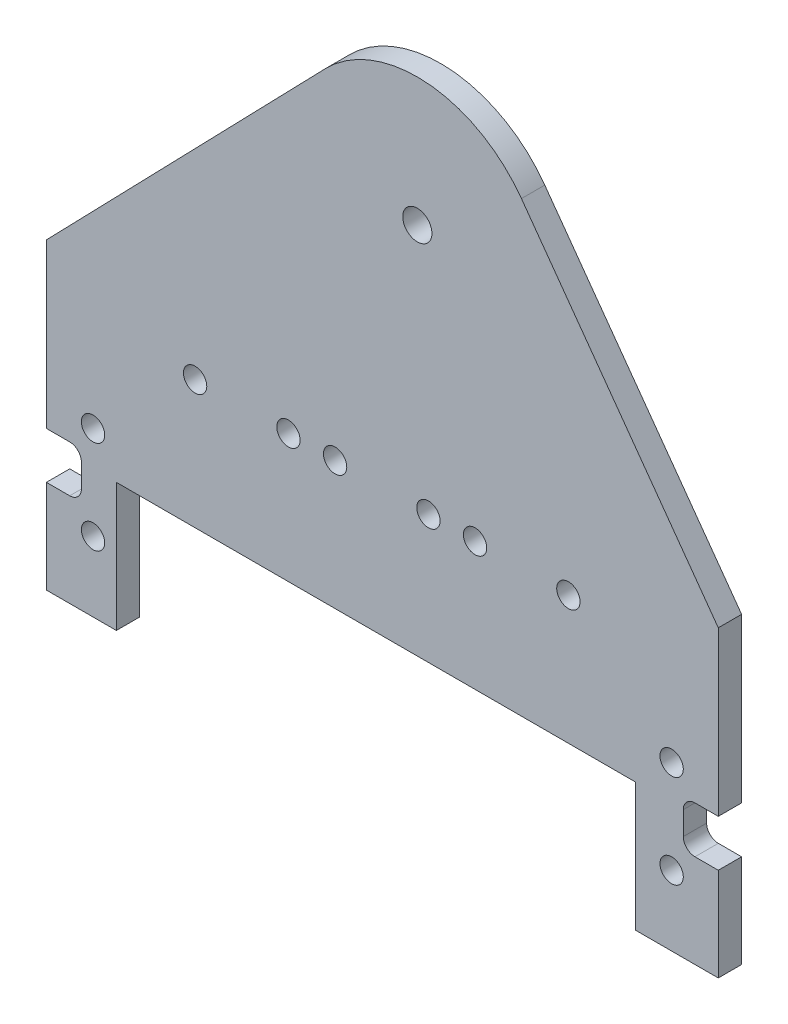
from build123d import *

# Parameters (mm, degrees)
SKETCH_1_R      = 1.25
SKETCH_1_R_2    = 1
EXTRUDE_1_DEPTH = 2


with BuildPart() as part:
    # 草圖1 → 填料-伸長1 (new body)
    with BuildSketch(Plane.XY):
        with BuildLine():
            Line((-28.8, -32), (-28.8, -34))
            ThreePointArc((-28.8, -34), (-29.092893219, -34.707106781), (-29.8, -35))
            Line((-29.8, -35), (-31.8, -35))
            Line((-31.8, -35), (-31.8, -36))
            Line((-31.8, -36), (-31.8, -42))
            Line((-31.8, -42), (-31.8, -43))
            Line((-31.8, -43), (-30.8, -43))
            Line((-30.8, -43), (-26.8, -43))
            Line((-26.8, -43), (-25.8, -43))
            Line((-25.8, -43), (-25.8, -32))
            Line((-25.8, -32), (18.7, -32))
            Line((18.7, -32), (18.7, -43))
            Line((18.7, -43), (24.8, -43))
            Line((24.8, -43), (25.8, -43))
            Line((25.8, -43), (25.8, -42))
            Line((25.8, -42), (25.8, -36))
            Line((25.8, -36), (25.8, -35))
            Line((25.8, -35), (23.8, -35))
            ThreePointArc((23.8, -35), (23.092893219, -34.707106781), (22.8, -34))
            Line((22.8, -34), (22.8, -32))
            ThreePointArc((22.8, -32), (23.092893219, -31.292893219), (23.8, -31))
            Line((23.8, -31), (25.8, -31))
            Line((25.8, -31), (25.8, -18))
            Line((25.8, -18), (25.8, -17))
            Line((25.8, -17), (8.925896882, 6.428714091))
            ThreePointArc((8.925896882, 6.428714091), (0.800566406, 10.970829204), (-7.898074186, 7.656397596))
            Line((-7.898074186, 7.656397596), (-31.8, -17))
            Line((-31.8, -17), (-31.8, -18))
            Line((-31.8, -18), (-31.8, -31))
            Line((-31.8, -31), (-29.8, -31))
            ThreePointArc((-29.8, -31), (-29.092893219, -31.292893219), (-28.8, -32))
        make_face()
        Circle(SKETCH_1_R, mode=Mode.SUBTRACT)
        with Locations((-19.05, -21)):
            Circle(SKETCH_1_R_2, mode=Mode.SUBTRACT)
        with Locations((-11.05, -21)):
            Circle(SKETCH_1_R_2, mode=Mode.SUBTRACT)
        with Locations((4.95, -21)):
            Circle(SKETCH_1_R_2, mode=Mode.SUBTRACT)
        with Locations((12.95, -21)):
            Circle(SKETCH_1_R_2, mode=Mode.SUBTRACT)
        with Locations((-27.8, -29)):
            Circle(SKETCH_1_R_2, mode=Mode.SUBTRACT)
        with Locations((-27.8, -37)):
            Circle(SKETCH_1_R_2, mode=Mode.SUBTRACT)
        with Locations(Location((21.8, -37, 0), (0, 0, 180))):
            Circle(SKETCH_1_R_2, mode=Mode.SUBTRACT)
        with Locations(Location((21.8, -29, 0), (0, 0, 180))):
            Circle(SKETCH_1_R_2, mode=Mode.SUBTRACT)
        with Locations((-7.05, -21)):
            Circle(SKETCH_1_R_2, mode=Mode.SUBTRACT)
        with Locations((0.95, -21)):
            Circle(SKETCH_1_R_2, mode=Mode.SUBTRACT)
    extrude(amount=EXTRUDE_1_DEPTH)


solid = part.part
